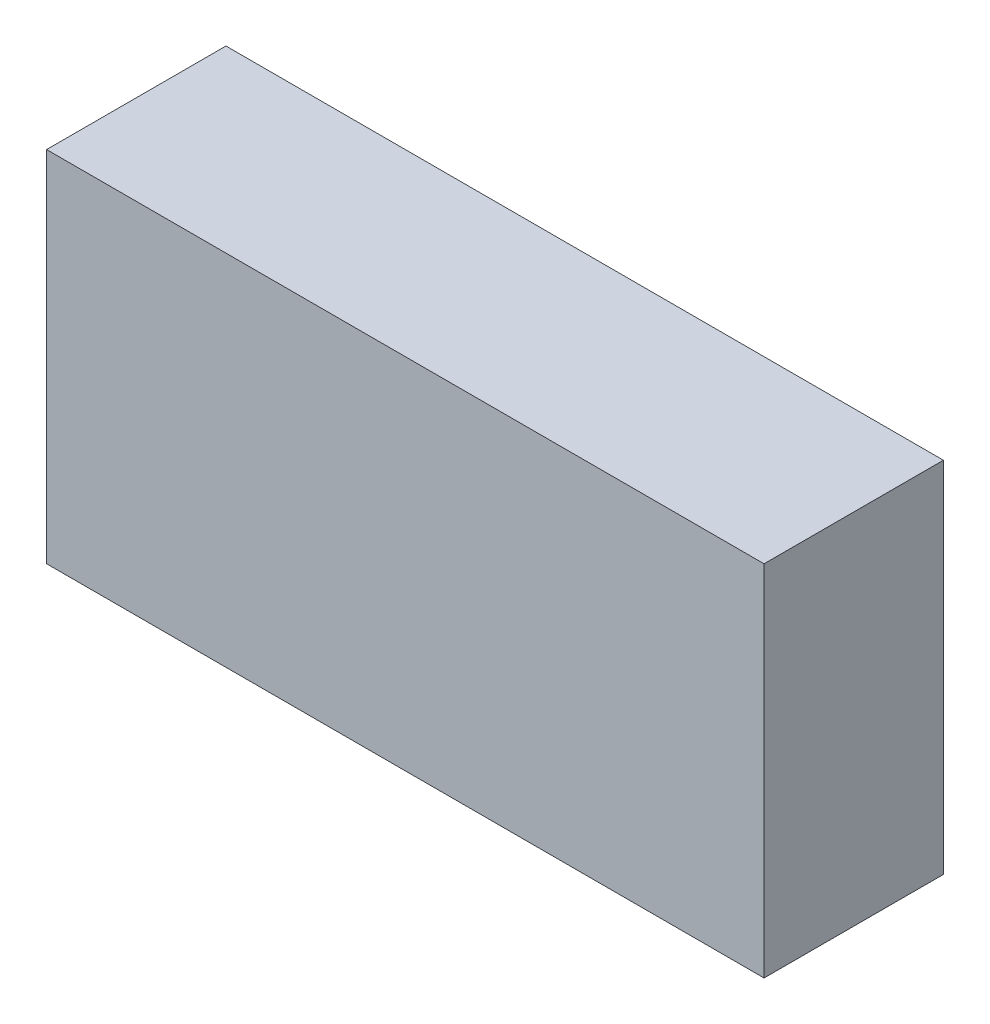
from build123d import *

# Parameters (mm, degrees)
SKETCH_1_W      = 40000
SKETCH_1_H      = 20000
EXTRUDE_1_DEPTH = 10000


with BuildPart() as part:
    # 草图1 → 凸台-拉伸1 (new body)
    with BuildSketch(Plane.XY):
        Rectangle(SKETCH_1_W, SKETCH_1_H)
    extrude(amount=-EXTRUDE_1_DEPTH)


solid = part.part
